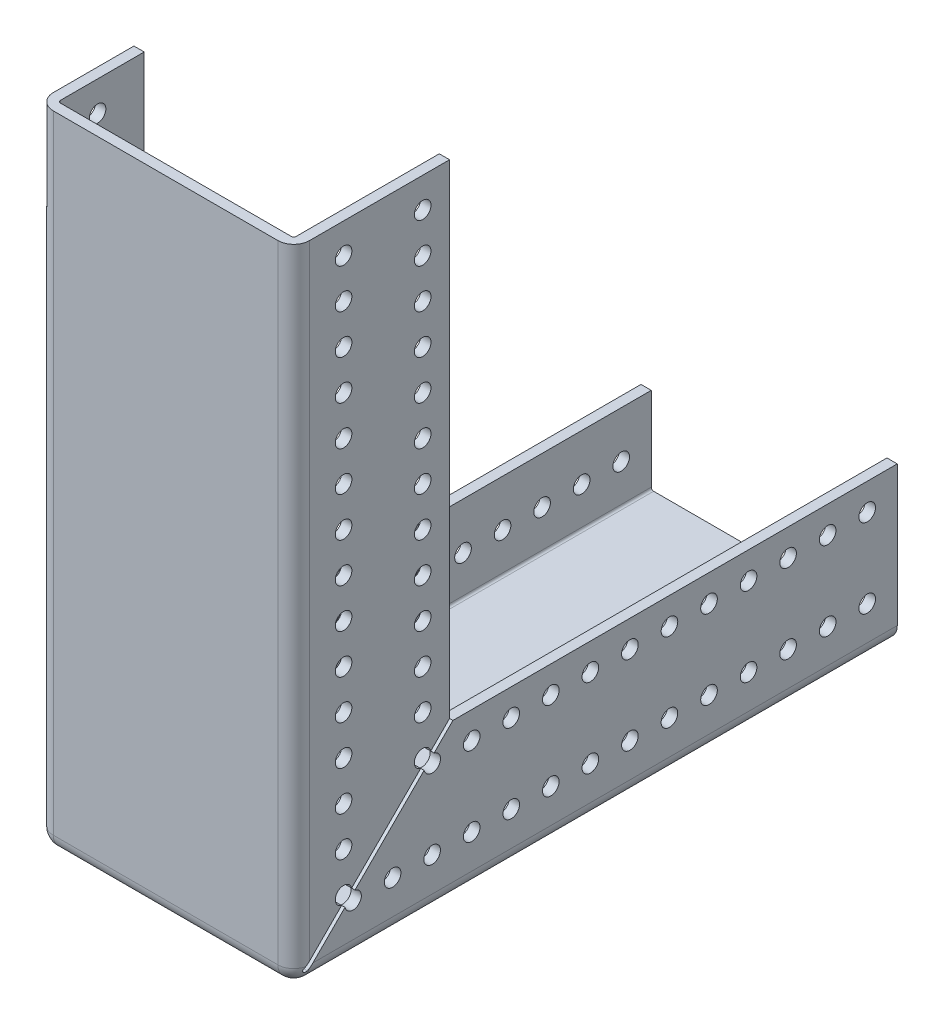
from build123d import *

# Parameters (mm, degrees)
SKETCH1_W           = 82.296
SKETCH1_H           = 193.802
BOSS_EXTRUDE1_DEPTH = 206.502
SKETCH2_W           = 75.692
SKETCH2_H           = 190.5
CUT_EXTRUDE1_DEPTH  = 203.2
CUT_EXTRUDE2_REACH  = 296.915
SKETCH3_W           = 162.814
SKETCH3_H           = 175.514
CUT_EXTRUDE4_REACH  = 296.915
SKETCH4_W           = 143.764
SKETCH4_H           = 156.464
FILLET1_R           = 0.762
FILLET2_R           = 5.08
CUT_EXTRUDE6_DEPTH  = 295.915111217
SKETCH6_R           = 2.667
CUT_EXTRUDE7_DEPTH  = 199.898


with BuildPart() as part:
    # Sketch1 → Boss-Extrude1 (new body)
    with BuildSketch(Plane(origin=(0, 0, 0), x_dir=(1, 0, 0), z_dir=(0, 1, 0))):
        with Locations((41.148, 96.901)):
            Rectangle(SKETCH1_W, SKETCH1_H)
    extrude(amount=BOSS_EXTRUDE1_DEPTH)

    # Sketch2 → Cut-Extrude1 (cut)
    with BuildSketch(Plane(origin=(0, 206.502, 0), x_dir=(1, 0, 0), z_dir=(0, 1, 0))):
        with Locations((41.148, 98.552)):
            Rectangle(SKETCH2_W, SKETCH2_H)
    extrude(amount=-CUT_EXTRUDE1_DEPTH, mode=Mode.SUBTRACT)

    # Sketch3 → Cut-Extrude2 (cut, up to next)
    with BuildSketch(Plane.ZY, mode=Mode.PRIVATE) as cut_extrude2_sk1:
        with Locations((-112.395, 118.745)):
            Rectangle(SKETCH3_W, SKETCH3_H)
    cut_extrude2_tool1 = extrude(cut_extrude2_sk1.sketch, amount=-CUT_EXTRUDE2_REACH, mode=Mode.PRIVATE) & part.part
    add(cut_extrude2_tool1.solids().sort_by_distance((0, 118.745, -112.395))[0], mode=Mode.SUBTRACT)

    # Sketch4 → Cut-Extrude4 (cut, up to next)
    with BuildSketch(Plane(origin=(82.296, 0, 0), x_dir=(0, 0, -1), z_dir=(1, 0, 0)), mode=Mode.PRIVATE) as cut_extrude4_sk1:
        with Locations((121.92, 128.27)):
            Rectangle(SKETCH4_W, SKETCH4_H)
    cut_extrude4_tool1 = extrude(cut_extrude4_sk1.sketch, amount=-CUT_EXTRUDE4_REACH, mode=Mode.PRIVATE) & part.part
    add(cut_extrude4_tool1.solids().sort_by_distance((82.296, 128.27, -121.92))[0], mode=Mode.SUBTRACT)

    # Fillet1
    fillet1_edges = [part.edges().sort_by_distance(p)[0] for p in [
        (3.302, 3.302, -98.552),
        (3.302, 104.902, -3.302),
        (78.994, 3.302, -98.552),
        (41.148, 3.302, -3.302),
        (78.994, 104.902, -3.302),
    ]]
    fillet(fillet1_edges, radius=FILLET1_R)

    # Fillet2
    fillet2_edges = [part.edges().sort_by_distance(p)[0] for p in [
        (82.296, 0, -96.901),
        (41.148, 0, 0),
        (0, 0, -96.901),
        (82.296, 103.251, 0),
        (0, 103.251, 0),
    ]]
    fillet(fillet2_edges, radius=FILLET2_R)

    # Sketch5 → Cut-Extrude6 (cut, through all)
    with BuildSketch(Plane(origin=(82.296, 0, 0), x_dir=(0, 0, -1), z_dir=(1, 0, 0))):
        with BuildLine():
            Line((3.525184633, 4.602815367), (57.389952996, 58.46758373))
            ThreePointArc((57.389952996, 58.46758373), (58.46758373, 58.46758373), (58.46758373, 57.389952996))
            Line((58.46758373, 57.389952996), (4.602815367, 3.525184633))
            ThreePointArc((4.602815367, 3.525184633), (3.525184633, 3.525184633), (3.525184633, 4.602815367))
        make_face()
    extrude(amount=-CUT_EXTRUDE6_DEPTH, mode=Mode.SUBTRACT)

    # Sketch6 → Cut-Extrude7 (cut)
    with BuildSketch(Plane(origin=(82.296, 0, 0), x_dir=(0, 0, -1), z_dir=(1, 0, 0))):
        with Locations((184.15, 41.402)):
            Circle(SKETCH6_R)
        with Locations((171.45, 41.402)):
            Circle(SKETCH6_R)
        with Locations((158.75, 41.402)):
            Circle(SKETCH6_R)
        with Locations((146.05, 41.402)):
            Circle(SKETCH6_R)
        with Locations((133.35, 41.402)):
            Circle(SKETCH6_R)
        with Locations((120.65, 41.402)):
            Circle(SKETCH6_R)
        with Locations((107.95, 41.402)):
            Circle(SKETCH6_R)
        with Locations((95.25, 41.402)):
            Circle(SKETCH6_R)
        with Locations((82.55, 41.402)):
            Circle(SKETCH6_R)
        with Locations((69.85, 41.402)):
            Circle(SKETCH6_R)
        with Locations((57.15, 41.402)):
            Circle(SKETCH6_R)
        with Locations((44.45, 41.402)):
            Circle(SKETCH6_R)
        with Locations((171.45, 16.002)):
            Circle(SKETCH6_R)
        with Locations((158.75, 16.002)):
            Circle(SKETCH6_R)
        with Locations((146.05, 16.002)):
            Circle(SKETCH6_R)
        with Locations((133.35, 16.002)):
            Circle(SKETCH6_R)
        with Locations((120.65, 16.002)):
            Circle(SKETCH6_R)
        with Locations((107.95, 16.002)):
            Circle(SKETCH6_R)
        with Locations((95.25, 16.002)):
            Circle(SKETCH6_R)
        with Locations((82.55, 16.002)):
            Circle(SKETCH6_R)
        with Locations((69.85, 16.002)):
            Circle(SKETCH6_R)
        with Locations((57.15, 16.002)):
            Circle(SKETCH6_R)
        with Locations((44.45, 16.002)):
            Circle(SKETCH6_R)
        with Locations((31.75, 16.002)):
            Circle(SKETCH6_R)
        with Locations((19.05, 16.002)):
            Circle(SKETCH6_R)
        with Locations((184.15, 16.002)):
            Circle(SKETCH6_R)
        with Locations((196.85, 16.002)):
            Circle(SKETCH6_R)
        with Locations((196.85, 41.402)):
            Circle(SKETCH6_R)
    cut_extrude7 = extrude(amount=-CUT_EXTRUDE7_DEPTH, mode=Mode.SUBTRACT)

    # Mirror1: Cut-Extrude7 across plane
    add(cut_extrude7.mirror(Plane(origin=(0, 0, 0), x_dir=(0, -0.7071067811865476, 0.7071067811865476), z_dir=(0, 0.7071067811865477, 0.7071067811865475))), mode=Mode.SUBTRACT)


solid = part.part
